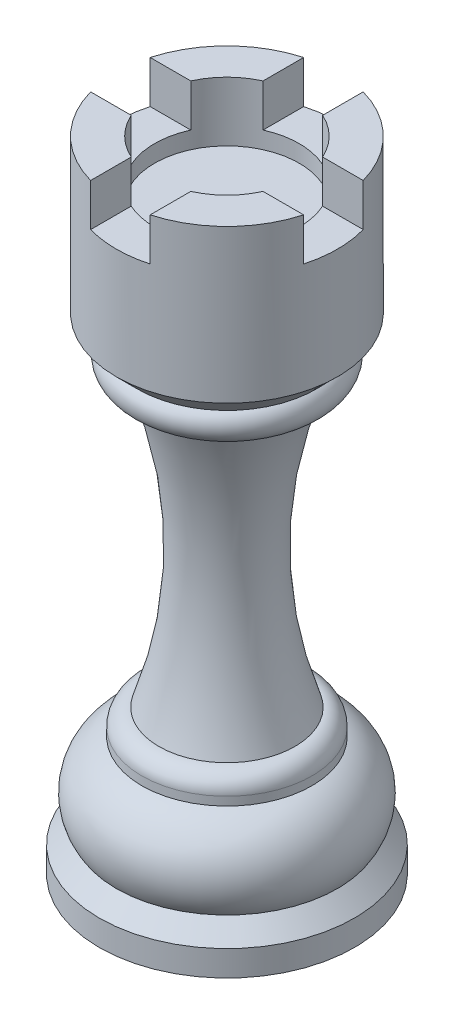
from build123d import *

# Parameters (mm, degrees)
CUT_EXTRUDE1_DEPTH = 5
CIRPATTERN1_COUNT  = 4


with BuildPart() as part:
    # Sketch1 → Revolve2 (revolve)
    with BuildSketch(Plane.XY, mode=Mode.PRIVATE) as revolve2_sk:
        with BuildLine():
            Line((0, 0), (-15, 0))
            Line((-15, 0), (-15, 3))
            Line((-15, 3), (-13, 5))
            ThreePointArc((-13, 5), (-13.688325627, 10.216881481), (-10, 13.97))
            Line((-10, 13.97), (-10, 14.97))
            ThreePointArc((-10, 14.97), (-9.414213562, 16.384213562), (-8, 16.97))
            ThreePointArc((-8, 16.97), (-5.234654729, 34.114083995), (-8.5, 51.17))
            ThreePointArc((-8.5, 51.17), (-11, 52.00581604), (-10.5, 54.593979182))
            Line((-10.5, 54.593979182), (-13, 57.093979182))
            Line((-13, 57.093979182), (-13, 75.093979182))
            Line((-13, 75.093979182), (-8.5, 75.093979182))
            Line((-8.5, 75.093979182), (-8.5, 68.093979182))
            Line((-8.5, 68.093979182), (0, 68.093979182))
            Line((0, 68.093979182), (0, 0))
        make_face()
    revolve(revolve2_sk.sketch.rotate(Axis((0, 75.093979182, 0), (0, -1, 0)), 270), axis=Axis((0, 75.093979182, 0), (0, -1, 0)))

    # Sketch2 → Cut-Extrude1 (cut)
    with BuildSketch(Plane(origin=(0, 75.093979182, 0), x_dir=(1, 0, 0), z_dir=(0, 1, 0))):
        with BuildLine():
            ThreePointArc((8.5, 0), (8.309353672, -1.790151267), (7.745966692, -3.5))
            Line((7.745966692, -3.5), (12.519984026, -3.5))
            ThreePointArc((12.519984026, -3.5), (12.879436951, -1.766381565), (13, 0))
            ThreePointArc((13, 0), (12.879436951, 1.766381565), (12.519984026, 3.5))
            Line((12.519984026, 3.5), (7.745966692, 3.5))
            ThreePointArc((7.745966692, 3.5), (8.309353672, 1.790151267), (8.5, 0))
        make_face()
    cut_extrude1 = extrude(amount=-CUT_EXTRUDE1_DEPTH, mode=Mode.SUBTRACT)

    # CirPattern1: Cut-Extrude1 ×4 about axis
    cirpattern1_axis = Axis((0, 0, 0), (0, 1, 0))
    for i in range(1, CIRPATTERN1_COUNT):
        add(cut_extrude1.rotate(cirpattern1_axis, i * 360 / CIRPATTERN1_COUNT), mode=Mode.SUBTRACT)


solid = part.part
